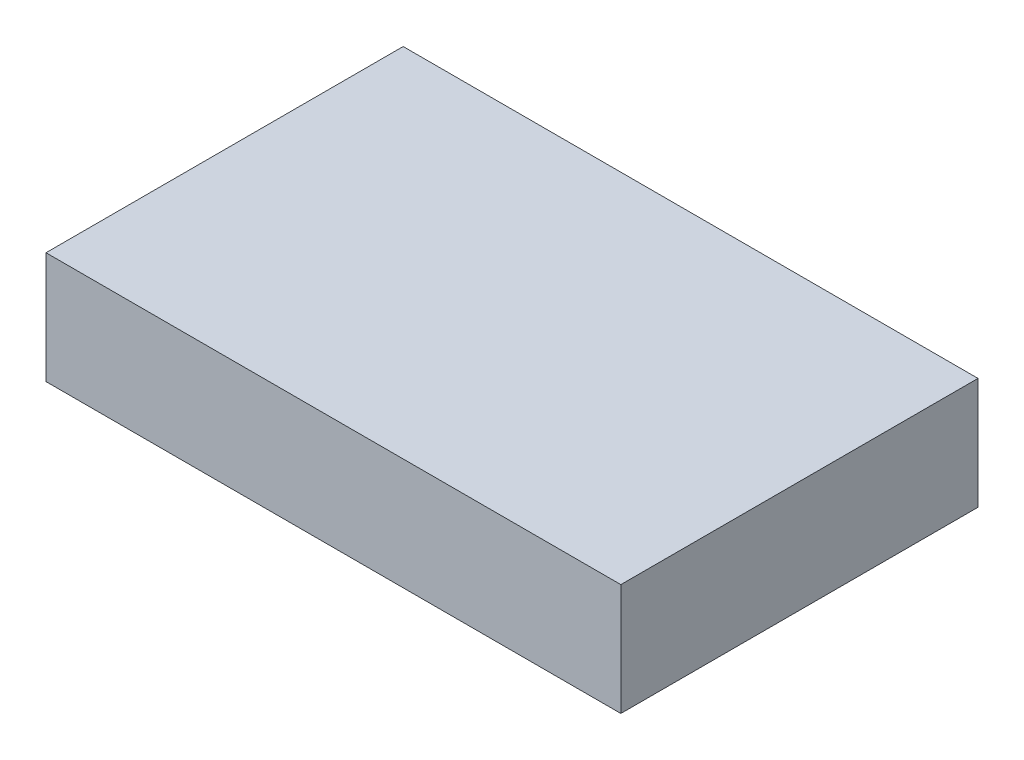
from build123d import *

# Parameters (mm, degrees)
SKETCH1_W           = 13.081
SKETCH1_H           = 8.128
BOSS_EXTRUDE1_DEPTH = 2.54


with BuildPart() as part:
    # Sketch1 → Boss-Extrude1 (new body)
    with BuildSketch(Plane(origin=(0, 0, 0), x_dir=(1, 0, 0), z_dir=(0, 1, 0))):
        Rectangle(SKETCH1_W, SKETCH1_H)
    extrude(amount=BOSS_EXTRUDE1_DEPTH)


solid = part.part
